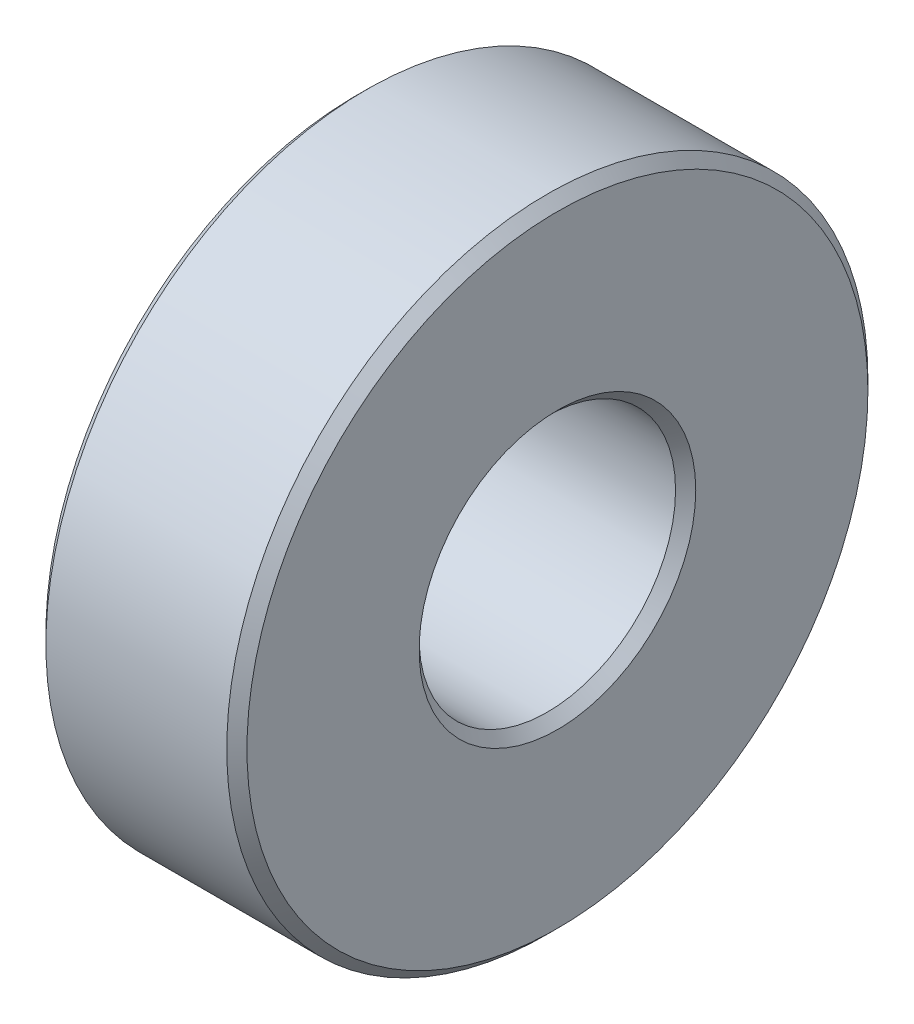
from build123d import *

# Parameters (mm, degrees)
SKETCH1_R           = 7.9375
SKETCH1_R_2         = 3.175
BOSS_EXTRUDE1_DEPTH = 2.489
CHAMFER1_SIZE       = 0.25


with BuildPart() as part:
    # Sketch1 → Boss-Extrude1 (new, symmetric)
    with BuildSketch(Plane(origin=(0, 0, 0), x_dir=(0, 0, -1), z_dir=(1, 0, 0))):
        Circle(SKETCH1_R)
        Circle(SKETCH1_R_2, mode=Mode.SUBTRACT)
    extrude(amount=BOSS_EXTRUDE1_DEPTH, both=True)

    # Chamfer1
    chamfer1_edges = [part.edges().sort_by_distance(p)[0] for p in [
        (-2.489, 0, 7.9375),
        (2.489, 0, 7.9375),
        (2.489, 0, 3.175),
    ]]
    chamfer(chamfer1_edges, length=CHAMFER1_SIZE)


solid = part.part
